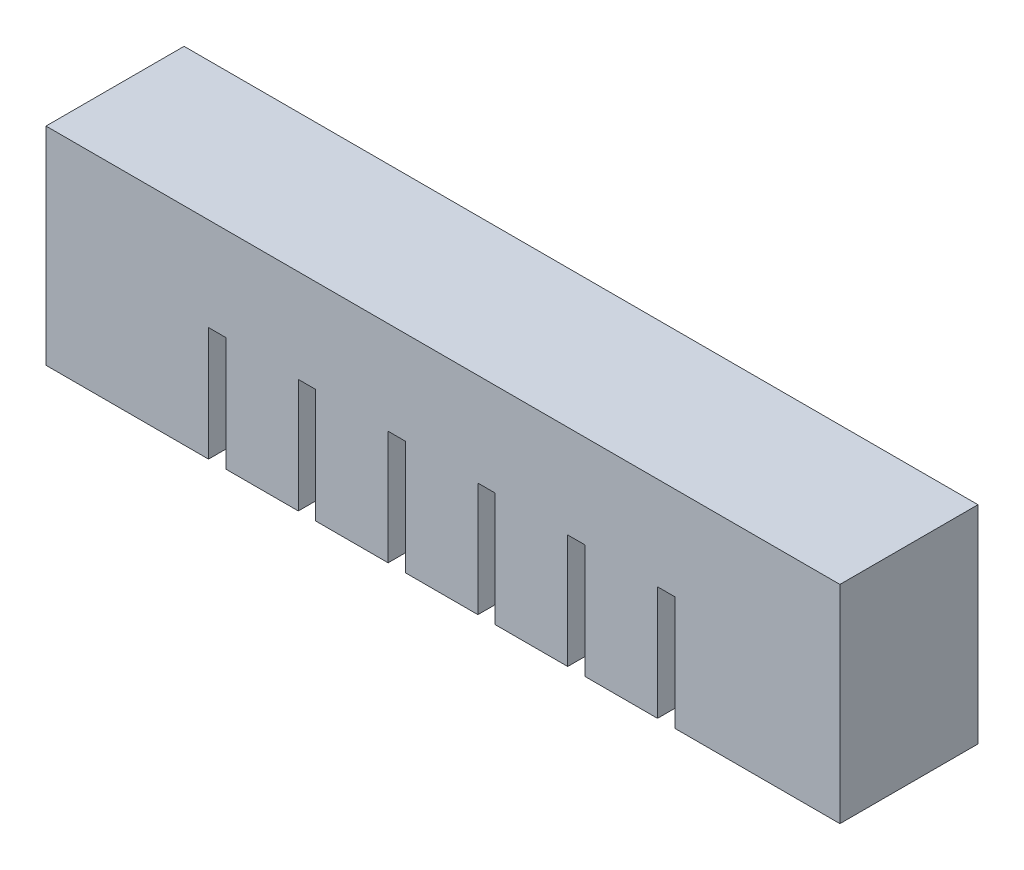
from build123d import *

# Parameters (mm, degrees)
EXTRUDE_1_DEPTH      = 10
EXTRUDE_1_DEPTH_BACK = 10
EXTRUDE_2_DEPTH      = 7.5
EXTRUDE_2_DEPTH_BACK = 7.5


with BuildPart() as part:
    # 草图1 → 凸台-拉伸1 (new, two sides: drawn at the far end of the back side and taken through both)
    with BuildSketch(Plane.XY.offset(-EXTRUDE_1_DEPTH_BACK)):
        Polygon((0, 0), (0, 30.015544123), (-115, 30.015544123), (-115, 0), (-95.049223988, 0), (-91.457964947, 0), (-91.457964947, 16.508549547), (-88.956671933, 16.508549547), (-88.956671933, 0), (-78.451224874, 0), (-78.451224874, 16.508549547), (-75.94993186, 16.508549547), (-75.94993186, 0), (-65.444492256, 0), (-65.444492256, 16.508549547), (-62.943199242, 16.508549547), (-62.943199242, 0), (-52.43775591, 0), (-52.43775591, 16.508549547), (-49.936459169, 16.508549547), (-49.936459169, 0), (-39.431019564, 0), (-39.431019564, 16.508549547), (-36.929722823, 16.508549547), (-36.929722823, 0), (-26.424285082, 0), (-26.424285082, 16.508549547), (-23.922990204, 16.508549547), (-23.922990204, 0), align=None)
    extrude(amount=EXTRUDE_1_DEPTH + EXTRUDE_1_DEPTH_BACK)


with BuildPart() as body_2:
    # 草图2 → 凸台-拉伸2 (new, two sides: drawn at the far end of the back side and taken through both)
    with BuildSketch(Plane.XY.offset(-EXTRUDE_2_DEPTH_BACK)):
        Polygon((-98.999999464, 21.999999881), (-98.999999464, 8.500000462), (-93.999996781, 8.500000462), (-93.999996781, 19.500000402), (-86.000002921, 19.500000402), (-86.000002921, 8.500000462), (-81.000000238, 8.500000462), (-81.000000238, 19.500000402), (-72.999998927, 19.500000402), (-72.999998927, 8.500000462), (-68.000003695, 8.500000462), (-68.000003695, 19.500000402), (-59.999998659, 19.500000402), (-59.999998659, 8.500000462), (-54.999999702, 8.500000462), (-54.999999702, 19.500000402), (-46.999998391, 19.500000402), (-46.999998391, 8.500000462), (-41.999999434, 8.500000462), (-41.999999434, 19.500000402), (-34.000001848, 19.500000402), (-34.000001848, 8.500000462), (-28.999999166, 8.500000462), (-28.999999166, 19.500000402), (-20.999999717, 19.500000402), (-20.999999717, 8.500000462), (-16.00000076, 8.500000462), (-16.00000076, 21.999999881), align=None)
    extrude(amount=EXTRUDE_2_DEPTH + EXTRUDE_2_DEPTH_BACK)


solid = Compound([part.part, body_2.part])
